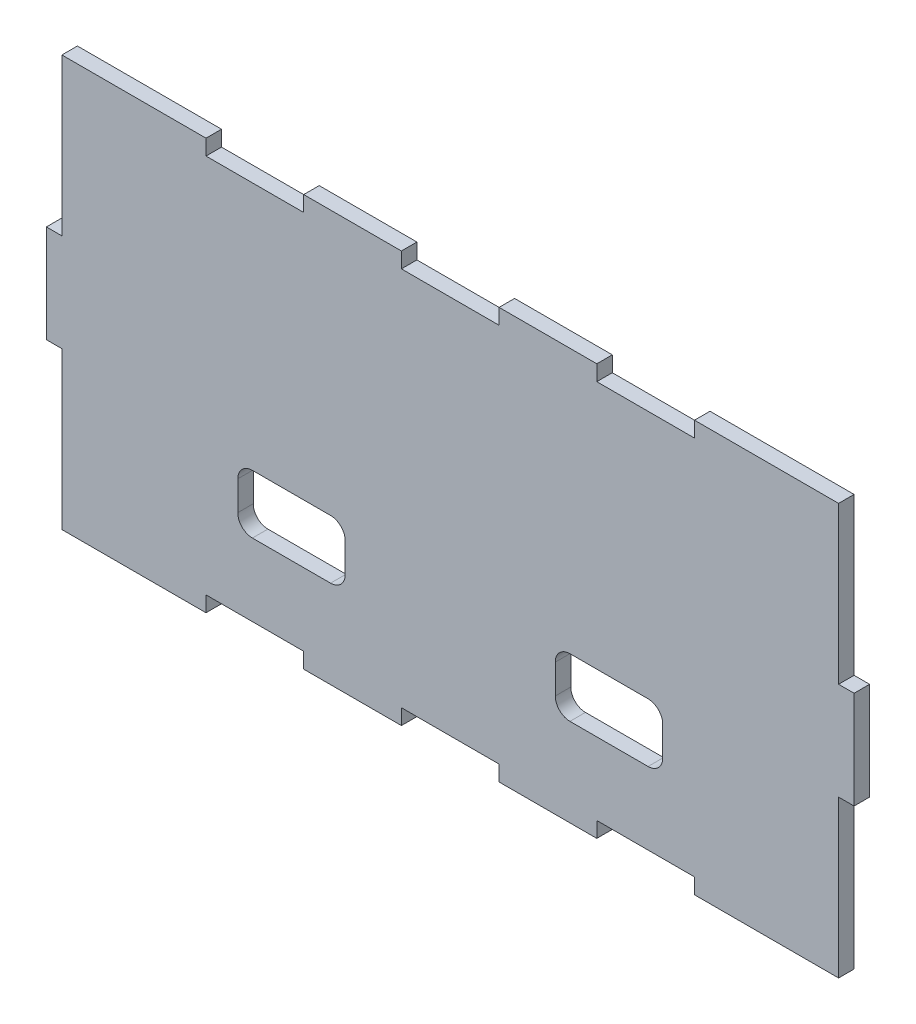
from build123d import *

# Parameters (mm, degrees)
ESQUISSE1_W             = 165.35
ESQUISSE1_H             = 84.146
BOSS_EXTRU_1_DEPTH      = 3.175
ESQUISSE2_W             = 3.175
ESQUISSE2_H             = 32.073
ENL_V_MAT_EXTRU_1_DEPTH = 93.819036727
ESQUISSE3_W             = 20
ESQUISSE3_H             = 3.175
ENL_V_MAT_EXTRU_2_DEPTH = 93.819036727
ESQUISSE5_W             = 22
ESQUISSE5_H             = 12
ENL_V_MAT_EXTRU_3_DEPTH = 93.819036727
CONG_1_R                = 3
CONG_1_OF_SYM_TRIE3_R   = 3


with BuildPart() as part:
    # Esquisse1 → Boss.-Extru.1 (new body)
    with BuildSketch(Plane.XY):
        Rectangle(ESQUISSE1_W, ESQUISSE1_H)
    extrude(amount=BOSS_EXTRU_1_DEPTH)

    # Esquisse2 → Enlèv. mat.-Extru.1 (cut, through all)
    with BuildSketch(Plane.XY.offset(3.175)):
        with Locations((-81.0875, -26.0365)):
            Rectangle(ESQUISSE2_W, ESQUISSE2_H)
        with Locations((-81.0875, 26.0365)):
            Rectangle(ESQUISSE2_W, ESQUISSE2_H)
    enl_v_mat_extru_1 = extrude(amount=-ENL_V_MAT_EXTRU_1_DEPTH, mode=Mode.SUBTRACT)

    # Symétrie1: Enlèv. mat.-Extru.1 across plane
    add(enl_v_mat_extru_1.mirror(Plane(origin=(0, 0, 0), x_dir=(0, 0, 1), z_dir=(1, 0, 0))), mode=Mode.SUBTRACT)

    # Esquisse3 → Enlèv. mat.-Extru.2 (cut, through all)
    with BuildSketch(Plane.XY.offset(3.175)):
        with Locations((0, -40.4855)):
            Rectangle(ESQUISSE3_W, ESQUISSE3_H)
        with Locations((40, -40.4855)):
            Rectangle(ESQUISSE3_W, ESQUISSE3_H)
        with Locations((-40, -40.4855)):
            Rectangle(ESQUISSE3_W, ESQUISSE3_H)
    enl_v_mat_extru_2 = extrude(amount=-ENL_V_MAT_EXTRU_2_DEPTH, mode=Mode.SUBTRACT)

    # Symétrie2: Enlèv. mat.-Extru.2 across plane
    add(enl_v_mat_extru_2.mirror(Plane.ZX), mode=Mode.SUBTRACT)

    # Esquisse5 → Enlèv. mat.-Extru.3 (cut, through all)
    with BuildSketch(Plane.XY.offset(3.175)):
        with Locations((32.5, -18.073)):
            Rectangle(ESQUISSE5_W, ESQUISSE5_H)
    enl_v_mat_extru_3 = extrude(amount=-ENL_V_MAT_EXTRU_3_DEPTH, mode=Mode.SUBTRACT)

    # Congé1
    cong_1_edges = [part.edges().sort_by_distance(p)[0] for p in [
        (21.5, -24.073, 1.5875),
        (21.5, -12.073, 1.5875),
        (43.5, -12.073, 1.5875),
        (43.5, -24.073, 1.5875),
    ]]
    fillet(cong_1_edges, radius=CONG_1_R)

    # Symétrie3: Enlèv. mat.-Extru.3 across plane
    add(enl_v_mat_extru_3.mirror(Plane(origin=(0, 0, 0), x_dir=(0, 0, 1), z_dir=(1, 0, 0))), mode=Mode.SUBTRACT)

    # Congé1 of Symétrie3
    cong_1_of_sym_trie3_edges = [part.edges().sort_by_distance(p)[0] for p in [
        (-21.5, -24.073, 1.5875),
        (-21.5, -12.073, 1.5875),
        (-43.5, -12.073, 1.5875),
        (-43.5, -24.073, 1.5875),
    ]]
    fillet(cong_1_of_sym_trie3_edges, radius=CONG_1_OF_SYM_TRIE3_R)


solid = part.part
